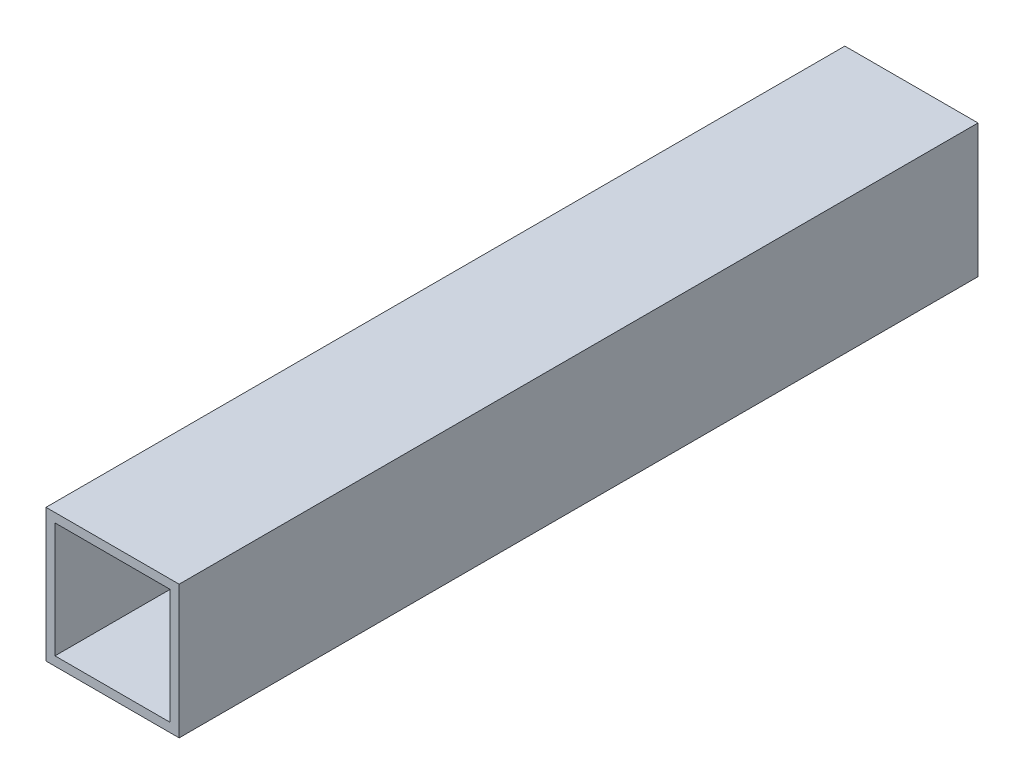
from build123d import *

# Parameters (mm, degrees)
SKETCH1_W           = 25.4
SKETCH1_H           = 25.4
SKETCH1_W_2         = 21.971
SKETCH1_H_2         = 21.971
BOSS_EXTRUDE1_DEPTH = 76.2


with BuildPart() as part:
    # Sketch1 → Boss-Extrude1 (new, symmetric)
    with BuildSketch(Plane.XY):
        Rectangle(SKETCH1_W, SKETCH1_H)
        Rectangle(SKETCH1_W_2, SKETCH1_H_2, mode=Mode.SUBTRACT)
    extrude(amount=BOSS_EXTRUDE1_DEPTH, both=True)


solid = part.part
